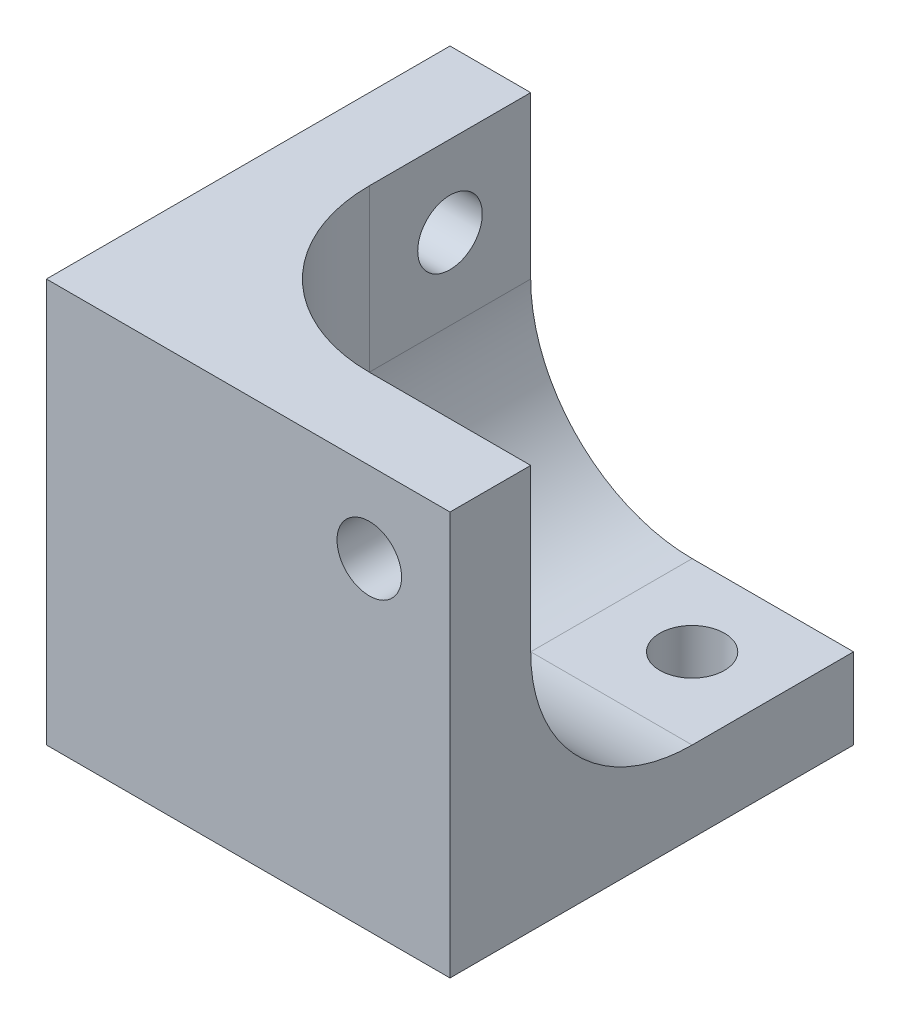
from build123d import *

# Parameters (mm, degrees)
SKETCH1_W           = 50
SKETCH1_H           = 50
BOSS_EXTRUDE1_DEPTH = 50
SKETCH3_W           = 40
SKETCH3_H           = 40
CUT_EXTRUDE1_DEPTH  = 40
SKETCH4_R           = 4
CUT_EXTRUDE2_DEPTH  = 40
SKETCH5_R           = 4
CUT_EXTRUDE3_DEPTH  = 40
SKETCH6_R           = 4
CUT_EXTRUDE4_DEPTH  = 40
FILLET1_R           = 20
FILLET2_R           = 20


with BuildPart() as part:
    # Sketch1 → Boss-Extrude1 (new body)
    with BuildSketch(Plane(origin=(0, 0, 0), x_dir=(1, 0, 0), z_dir=(0, 1, 0))):
        with Locations((25, 25)):
            Rectangle(SKETCH1_W, SKETCH1_H)
    extrude(amount=BOSS_EXTRUDE1_DEPTH)

    # Sketch3 → Cut-Extrude1 (cut)
    with BuildSketch(Plane(origin=(0, 50, 0), x_dir=(1, 0, 0), z_dir=(0, 1, 0))):
        with Locations((30, 30)):
            Rectangle(SKETCH3_W, SKETCH3_H)
    extrude(amount=-CUT_EXTRUDE1_DEPTH, mode=Mode.SUBTRACT)

    # Sketch4 → Cut-Extrude2 (cut)
    with BuildSketch(Plane(origin=(0, 10, 0), x_dir=(1, 0, 0), z_dir=(0, 1, 0))):
        with Locations(Location((40, 40, 0), (0, 0, 270))):
            Circle(SKETCH4_R)
    extrude(amount=-CUT_EXTRUDE2_DEPTH, mode=Mode.SUBTRACT)

    # Sketch5 → Cut-Extrude3 (cut)
    with BuildSketch(Plane.XY):
        with Locations((40, 40)):
            Circle(SKETCH5_R)
    extrude(amount=-CUT_EXTRUDE3_DEPTH, mode=Mode.SUBTRACT)

    # Sketch6 → Cut-Extrude4 (cut)
    with BuildSketch(Plane.ZY):
        with Locations((-40, 40)):
            Circle(SKETCH6_R)
    extrude(amount=-CUT_EXTRUDE4_DEPTH, mode=Mode.SUBTRACT)

    # Fillet1
    fillet1_edges = [part.edges().sort_by_distance(p)[0] for p in [
        (10, 30, -10),
    ]]
    fillet(fillet1_edges, radius=FILLET1_R)

    # Fillet2
    fillet2_edges = [part.edges().sort_by_distance(p)[0] for p in [
        (10, 10, -40),
        (40, 10, -10),
        (15.857864376, 10, -15.857864376),
    ]]
    fillet(fillet2_edges, radius=FILLET2_R)


solid = part.part
